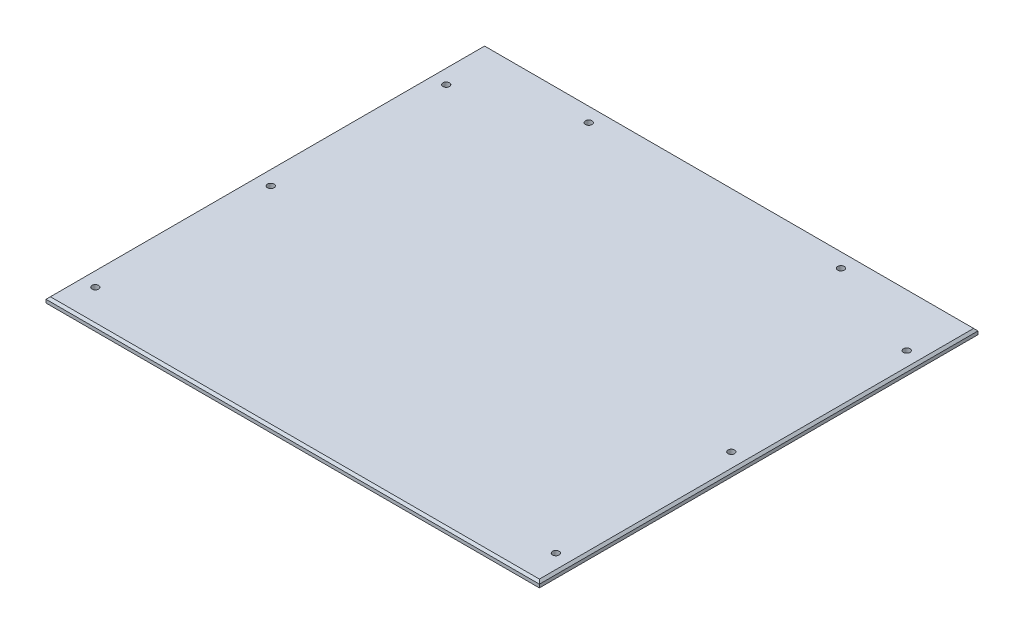
from build123d import *

# Parameters (mm, degrees)
CROQUIS1_W              = 450
CROQUIS1_H              = 400
CROQUIS1_R              = 3
SALIENTE_EXTRUIR1_DEPTH = 5
CHAFL_N1_SIZE           = 2


with BuildPart() as part:
    # Croquis1 → Saliente-Extruir1 (new body)
    with BuildSketch(Plane(origin=(0, 0, 0), x_dir=(1, 0, 0), z_dir=(0, 1, 0))):
        with Locations((36.673151751, -29.571984436)):
            Rectangle(CROQUIS1_W, CROQUIS1_H)
        with Locations(Location((-173.326848249, 120.428015564, 0), (0, 0, 270))):
            Circle(CROQUIS1_R, mode=Mode.SUBTRACT)
        with Locations(Location((-173.326848249, -199.571984436, 0), (0, 0, 270))):
            Circle(CROQUIS1_R, mode=Mode.SUBTRACT)
        with Locations(Location((246.673151751, -199.571984436, 0), (0, 0, 270))):
            Circle(CROQUIS1_R, mode=Mode.SUBTRACT)
        with Locations(Location((246.673151751, 120.428015564, 0), (0, 0, 270))):
            Circle(CROQUIS1_R, mode=Mode.SUBTRACT)
        with Locations(Location((-173.326848249, -39.571984436, 0), (0, 0, 270))):
            Circle(CROQUIS1_R, mode=Mode.SUBTRACT)
        with Locations(Location((246.673151751, -39.571984436, 0), (0, 0, 270))):
            Circle(CROQUIS1_R, mode=Mode.SUBTRACT)
        with Locations(Location((-78.326848249, 155.428015564, 0), (0, 0, 270))):
            Circle(CROQUIS1_R, mode=Mode.SUBTRACT)
        with Locations(Location((151.673151751, 155.428015564, 0), (0, 0, 270))):
            Circle(CROQUIS1_R, mode=Mode.SUBTRACT)
    extrude(amount=SALIENTE_EXTRUIR1_DEPTH)

    # Chaflán1
    chafl_n1_edges = [part.edges().sort_by_distance(p)[0] for p in [
        (261.673151751, 5, 29.571984436),
        (36.673151751, 5, -170.428015564),
        (-188.326848249, 5, 29.571984436),
        (36.673151751, 5, 229.571984436),
    ]]
    chamfer(chafl_n1_edges, length=CHAFL_N1_SIZE)


solid = part.part
